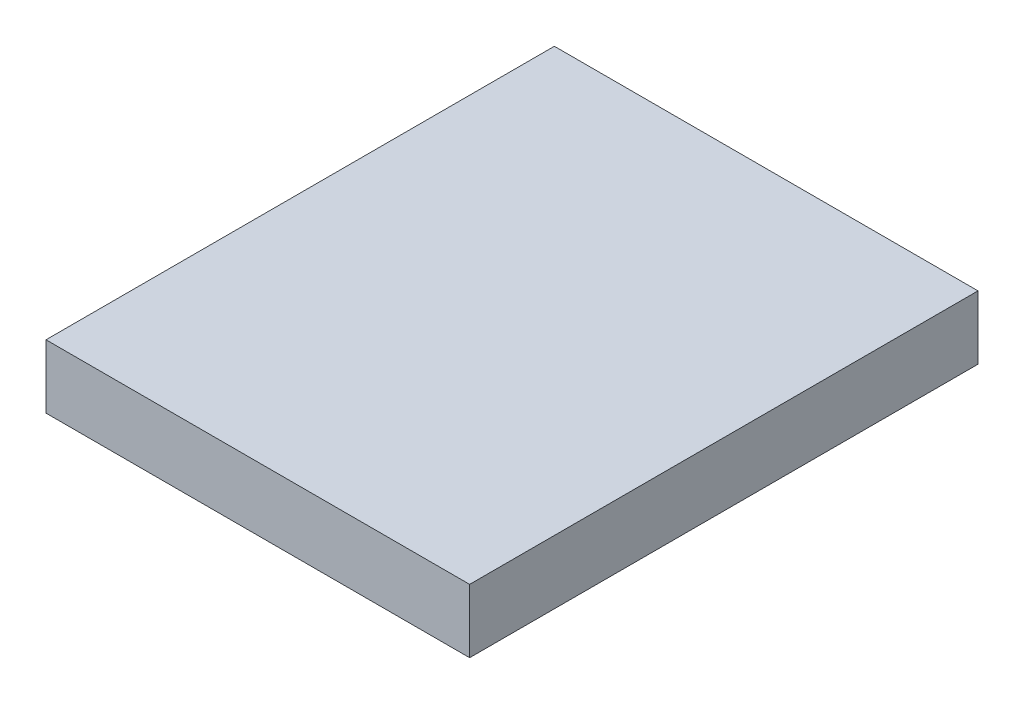
from build123d import *

# Parameters (mm, degrees)
SKETCH1_W           = 5
SKETCH1_H           = 6
BOSS_EXTRUDE1_DEPTH = 0.75


with BuildPart() as part:
    # Sketch1 → Boss-Extrude1 (new body)
    with BuildSketch(Plane(origin=(0, 0, 0), x_dir=(1, 0, 0), z_dir=(0, 1, 0))):
        Rectangle(SKETCH1_W, SKETCH1_H)
    extrude(amount=BOSS_EXTRUDE1_DEPTH)


solid = part.part
